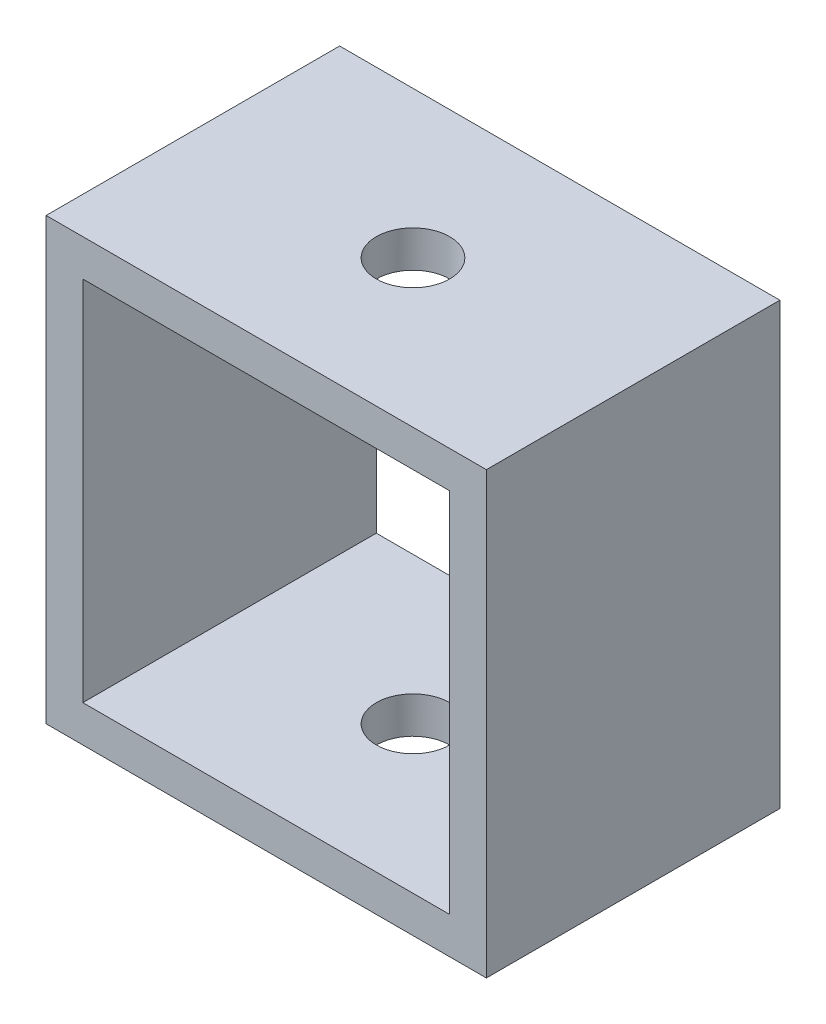
from build123d import *

# Parameters (mm, degrees)
SKETCH1_W        = 38.1
SKETCH1_H        = 25.4
EXTRUSION1_DEPTH = 38.1
SHELL1_T         = -3.175
HOLE1_D          = 6.35
SKETCH4_W        = 38.1
SKETCH4_H        = 38.1
SKETCH4_W_2      = 31.75
SKETCH4_H_2      = 31.75
EXTRUSION2_DEPTH = 5.3848
SKETCH5_W        = 38.1
SKETCH5_H        = 5.3848
EXTRUSION3_DEPTH = 38.1


with BuildPart() as part:
    # Sketch1 → Extrusion1 (new body)
    with BuildSketch(Plane(origin=(0, 0, 0), x_dir=(-1, 0, 0), z_dir=(0, 1, 0))):
        Rectangle(SKETCH1_W, SKETCH1_H)
    extrude(amount=EXTRUSION1_DEPTH)

    # Shell1
    shell1_openings = [part.faces().sort_by_distance(p)[0] for p in [
        (0, 19.05, 12.7),
        (0, 19.05, -12.7),
    ]]
    offset(amount=SHELL1_T, openings=shell1_openings, kind=Kind.INTERSECTION)

    # Hole1 (through all)
    with Locations(Plane(origin=(0, 38.1, 0), x_dir=(1, 0, 0), z_dir=(0, 1, 0))):
        with Locations((0, 0)):
            Hole(HOLE1_D / 2)

    # Sketch4 → Extrusion2 (add)
    with BuildSketch(Plane.XY.offset(12.7)):
        with Locations((0, 19.05)):
            Rectangle(SKETCH4_W, SKETCH4_H)
        with Locations((0, 19.05)):
            Rectangle(SKETCH4_W_2, SKETCH4_H_2, mode=Mode.SUBTRACT)
    extrude(amount=EXTRUSION2_DEPTH)

    # Sketch5 → Extrusion3 (cut)
    with BuildSketch(Plane(origin=(0, 38.1, 0), x_dir=(1, 0, 0), z_dir=(0, 1, 0))):
        with Locations((0, -15.3924)):
            Rectangle(SKETCH5_W, SKETCH5_H)
    extrude(amount=-EXTRUSION3_DEPTH, mode=Mode.SUBTRACT)


solid = part.part
